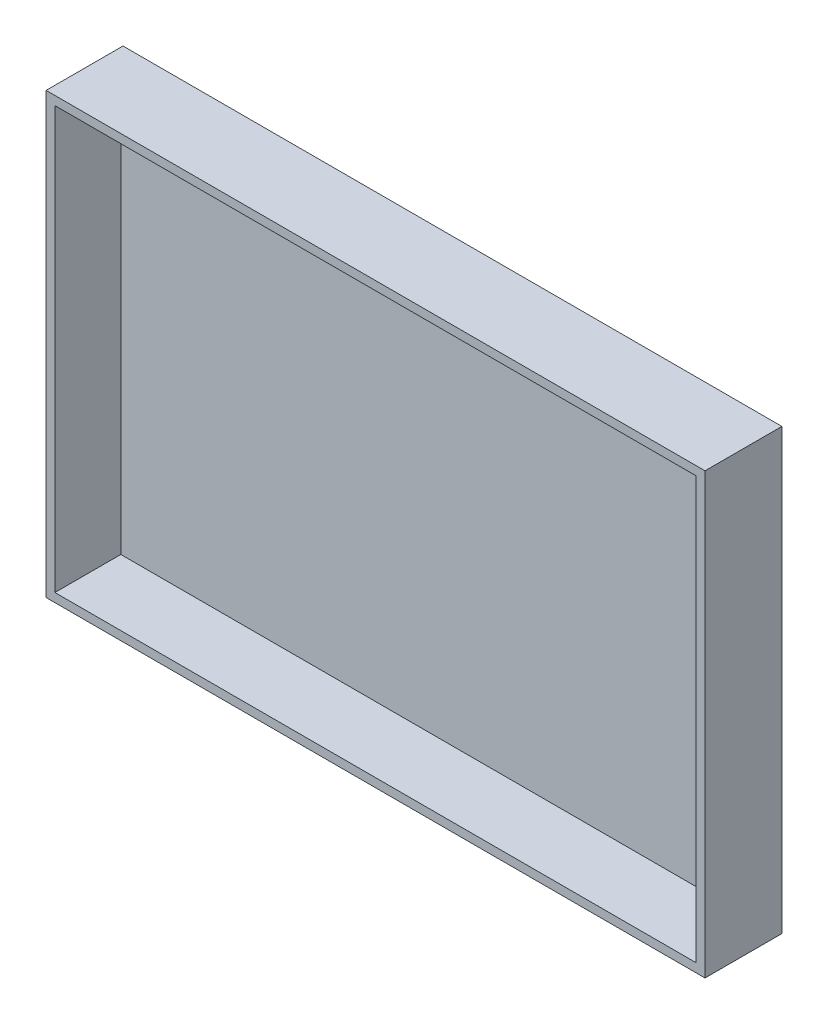
from build123d import *

# Parameters (mm, degrees)
ESQUISSE1_W        = 600
ESQUISSE1_H        = 400
BOSS_EXTRU_1_DEPTH = 10
ESQUISSE2_W        = 600
ESQUISSE2_H        = 400
ESQUISSE2_W_2      = 584
ESQUISSE2_H_2      = 384
BOSS_EXTRU_2_DEPTH = 60


with BuildPart() as part:
    # Esquisse1 → Boss.-Extru.1 (new body)
    with BuildSketch(Plane.XY):
        with Locations((300, 200)):
            Rectangle(ESQUISSE1_W, ESQUISSE1_H)
    extrude(amount=BOSS_EXTRU_1_DEPTH)

    # Esquisse2 → Boss.-Extru.2 (add)
    with BuildSketch(Plane.XY.offset(10)):
        with Locations((300, 200)):
            Rectangle(ESQUISSE2_W, ESQUISSE2_H)
        with Locations((300, 200)):
            Rectangle(ESQUISSE2_W_2, ESQUISSE2_H_2, mode=Mode.SUBTRACT)
    extrude(amount=BOSS_EXTRU_2_DEPTH)


solid = part.part
